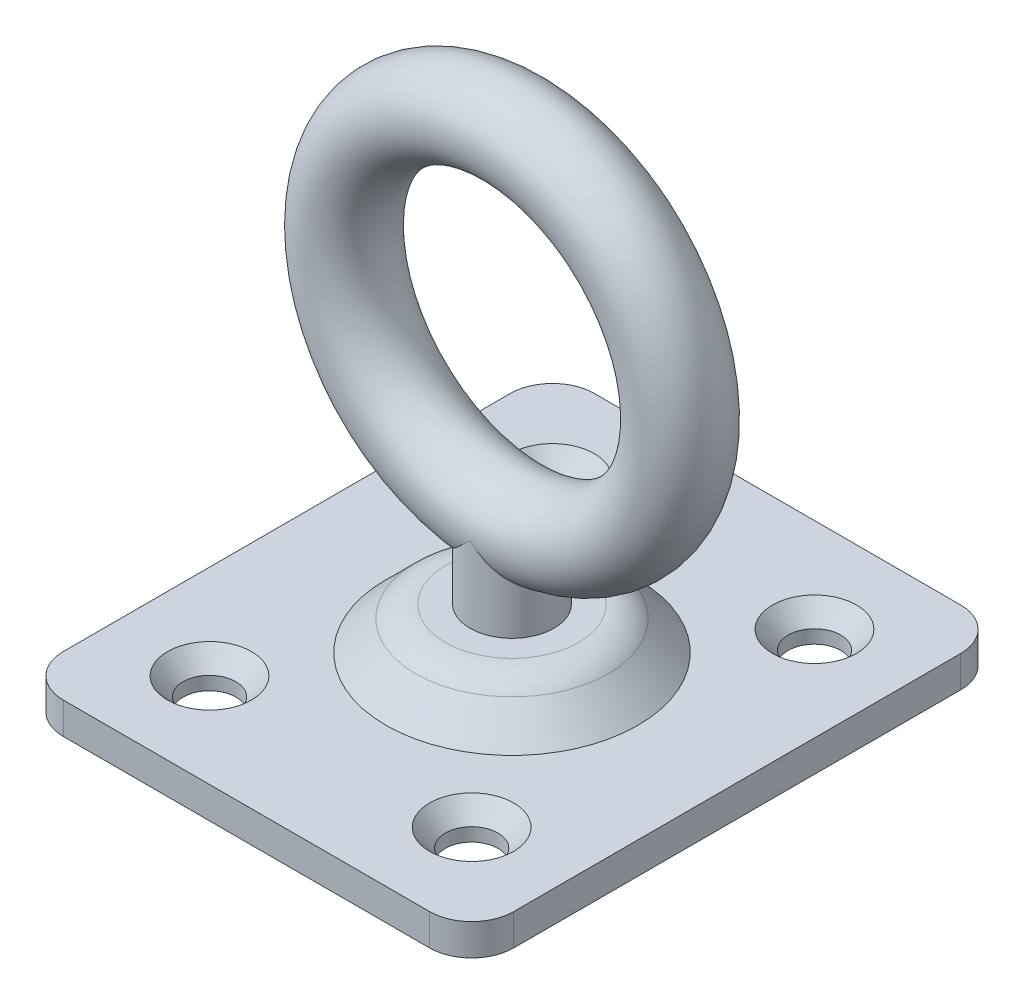
from build123d import *

# Parameters (mm, degrees)
BOSS_EXTRUDE1_DEPTH = 2.38125
CUT_EXTRUDE1_REACH  = 28.418
SKETCH2_R           = 1.984375
SKETCH6_R           = 4.7625
SKETCH6_R_2         = 3.175
BOSS_EXTRUDE2_DEPTH = 1.190625
SKETCH9_R           = 3.175


with BuildPart() as part:
    # Sketch1 → Boss-Extrude1 (new body)
    with BuildSketch(Plane(origin=(0, 0, 0), x_dir=(1, 0, 0), z_dir=(0, 1, 0))):
        with BuildLine():
            Line((-13.843, 20.066), (13.843, 20.066))
            ThreePointArc((13.843, 20.066), (16.08806403, 19.13606403), (17.018, 16.891))
            Line((17.018, 16.891), (17.018, -16.891))
            ThreePointArc((17.018, -16.891), (16.08806403, -19.13606403), (13.843, -20.066))
            Line((13.843, -20.066), (-13.843, -20.066))
            ThreePointArc((-13.843, -20.066), (-16.08806403, -19.13606403), (-17.018, -16.891))
            Line((-17.018, -16.891), (-17.018, 16.891))
            ThreePointArc((-17.018, 16.891), (-16.08806403, 19.13606403), (-13.843, 20.066))
        make_face()
    extrude(amount=BOSS_EXTRUDE1_DEPTH)

    # Sketch2 → Cut-Extrude1 (cut, up to next)
    with BuildSketch(Plane(origin=(0, 0, 0), x_dir=(1, 0, 0), z_dir=(0, 1, 0)), mode=Mode.PRIVATE) as cut_extrude1_sk1:
        with Locations(Location((-9.906, 12.954, 0), (0, 0, 270))):
            Circle(SKETCH2_R)
    cut_extrude1_tool1 = extrude(cut_extrude1_sk1.sketch, amount=CUT_EXTRUDE1_REACH, mode=Mode.PRIVATE) & part.part
    # Sketch2 → Cut-Extrude1 (cut, up to next)
    with BuildSketch(Plane(origin=(0, 0, 0), x_dir=(1, 0, 0), z_dir=(0, 1, 0)), mode=Mode.PRIVATE) as cut_extrude1_sk2:
        with Locations(Location((9.906, 12.954, 0), (0, 0, 270))):
            Circle(SKETCH2_R)
    cut_extrude1_tool2 = extrude(cut_extrude1_sk2.sketch, amount=CUT_EXTRUDE1_REACH, mode=Mode.PRIVATE) & part.part
    # Sketch2 → Cut-Extrude1 (cut, up to next)
    with BuildSketch(Plane(origin=(0, 0, 0), x_dir=(1, 0, 0), z_dir=(0, 1, 0)), mode=Mode.PRIVATE) as cut_extrude1_sk3:
        with Locations(Location((9.906, -12.954, 0), (0, 0, 270))):
            Circle(SKETCH2_R)
    cut_extrude1_tool3 = extrude(cut_extrude1_sk3.sketch, amount=CUT_EXTRUDE1_REACH, mode=Mode.PRIVATE) & part.part
    # Sketch2 → Cut-Extrude1 (cut, up to next)
    with BuildSketch(Plane(origin=(0, 0, 0), x_dir=(1, 0, 0), z_dir=(0, 1, 0)), mode=Mode.PRIVATE) as cut_extrude1_sk4:
        with Locations(Location((-9.906, -12.954, 0), (0, 0, 270))):
            Circle(SKETCH2_R)
    cut_extrude1_tool4 = extrude(cut_extrude1_sk4.sketch, amount=CUT_EXTRUDE1_REACH, mode=Mode.PRIVATE) & part.part
    add(cut_extrude1_tool1.solids().sort_by_distance((-9.906, 0, -12.954))[0], mode=Mode.SUBTRACT)
    add(cut_extrude1_tool2.solids().sort_by_distance((9.906, 0, -12.954))[0], mode=Mode.SUBTRACT)
    add(cut_extrude1_tool3.solids().sort_by_distance((9.906, 0, 12.954))[0], mode=Mode.SUBTRACT)
    add(cut_extrude1_tool4.solids().sort_by_distance((-9.906, 0, 12.954))[0], mode=Mode.SUBTRACT)

    # Cut-Extrude2 cone 1 section (through the dimple's axis) → Cut-Extrude2 (revolve, cut)
    with BuildSketch(Plane(origin=(-9.906, 2.38125, -12.954), x_dir=(0, 0, 1), z_dir=(1, 0, 0))):
        Polygon((0, 0), (3.175, 0), (0, 3.652419693), align=None)
    revolve(axis=Axis((-9.906, 2.38125, -12.954), (0, -1, 0)), mode=Mode.SUBTRACT)

    # Cut-Extrude2 cone 2 section (through the dimple's axis) → Cut-Extrude2 cone 2 (revolve, cut)
    with BuildSketch(Plane(origin=(9.906, 2.38125, -12.954), x_dir=(0, 0, 1), z_dir=(1, 0, 0))):
        Polygon((0, 0), (3.175, 0), (0, 3.652419693), align=None)
    revolve(axis=Axis((9.906, 2.38125, -12.954), (0, -1, 0)), mode=Mode.SUBTRACT)

    # Cut-Extrude2 cone 3 section (through the dimple's axis) → Cut-Extrude2 cone 3 (revolve, cut)
    with BuildSketch(Plane(origin=(9.906, 2.38125, 12.954), x_dir=(0, 0, 1), z_dir=(1, 0, 0))):
        Polygon((0, 0), (3.175, 0), (0, 3.652419693), align=None)
    revolve(axis=Axis((9.906, 2.38125, 12.954), (0, -1, 0)), mode=Mode.SUBTRACT)

    # Cut-Extrude2 cone 4 section (through the dimple's axis) → Cut-Extrude2 cone 4 (revolve, cut)
    with BuildSketch(Plane(origin=(-9.906, 2.38125, 12.954), x_dir=(0, 0, 1), z_dir=(1, 0, 0))):
        Polygon((0, 0), (3.175, 0), (0, 3.652419693), align=None)
    revolve(axis=Axis((-9.906, 2.38125, 12.954), (0, -1, 0)), mode=Mode.SUBTRACT)

    # Sketch4 → Revolve1 (revolve)
    with BuildSketch(Plane.XY, mode=Mode.PRIVATE) as revolve1_sk:
        with BuildLine():
            Line((-9.525, 2.38125), (-7.27993597, 4.62631403))
            ThreePointArc((-7.27993597, 4.62631403), (-6.249891837, 5.314567516), (-5.034871939, 5.55625))
            Line((-5.034871939, 5.55625), (0, 5.55625))
            Line((0, 5.55625), (0, 2.38125))
            Line((0, 2.38125), (-9.525, 2.38125))
        make_face()
    revolve(revolve1_sk.sketch.rotate(Axis((0, 0, 0), (0, 1, 0)), 270), axis=Axis((0, 0, 0), (0, 1, 0)))

    # Sketch5 → Cut-Revolve1 (revolve, cut)
    with BuildSketch(Plane.XY, mode=Mode.PRIVATE) as cut_revolve1_sk:
        with BuildLine():
            Line((0, 5.55625), (-3.175, 5.55625))
            Line((-3.175, 5.55625), (-3.175, 3.175))
            Line((-3.175, 3.175), (-5.034871939, 3.175))
            ThreePointArc((-5.034871939, 3.175), (-5.338626914, 3.114579379), (-5.596137947, 2.942516008))
            Line((-5.596137947, 2.942516008), (-7.841201977, 0.697451977))
            ThreePointArc((-7.841201977, 0.697451977), (-8.613735077, 0.181261863), (-9.525, 0))
            Line((-9.525, 0), (0, 0))
            Line((0, 0), (0, 5.55625))
        make_face()
    revolve(cut_revolve1_sk.sketch.rotate(Axis((0, 39.878, 0), (0, -1, 0)), 270), axis=Axis((0, 39.878, 0), (0, -1, 0)), mode=Mode.SUBTRACT)


with BuildPart() as body_2:
    # Sketch6 → Boss-Extrude2 (new body)
    with BuildSketch(Plane.XZ.offset(-3.175)):
        with Locations(Location((0, 0, 0), (0, 0, 90))):
            Circle(SKETCH6_R)
        with Locations(Location((0, 0, 0), (0, 0, 90))):
            Circle(SKETCH6_R_2, mode=Mode.SUBTRACT)
    extrude(amount=BOSS_EXTRUDE2_DEPTH)


with BuildPart() as body_3:
    # Sketch7 → Revolve2 (revolve)
    with BuildSketch(Plane.XY, mode=Mode.PRIVATE) as revolve2_sk:
        with BuildLine():
            Line((-3.175, 11.303), (-3.175, 1.984375))
            Line((-3.175, 1.984375), (-3.96875, 1.984375))
            ThreePointArc((-3.96875, 1.984375), (-2.071748323, 1.09781809), (0, 0.79375))
            Line((0, 0.79375), (0, 11.303))
            Line((0, 11.303), (-3.175, 11.303))
        make_face()
    revolve(revolve2_sk.sketch.rotate(Axis((0, 39.878, 0), (0, -1, 0)), 270), axis=Axis((0, 39.878, 0), (0, -1, 0)))

    # Sweep1: sweep along a path in Sketch8
    with BuildLine(Plane.XY) as sweep1_path:
        CenterArc((0, 24.003), 12.7, 0, 360)
    # Sketch9 → Sweep1 (sweep)
    with BuildSketch(Plane(origin=(0, 0, 0), x_dir=(0, 0, -1), z_dir=(1, 0, 0))):
        with Locations((0, 36.703)):
            Circle(SKETCH9_R)
    sweep(path=sweep1_path.line)


solid = Compound([part.part, body_2.part, body_3.part])
